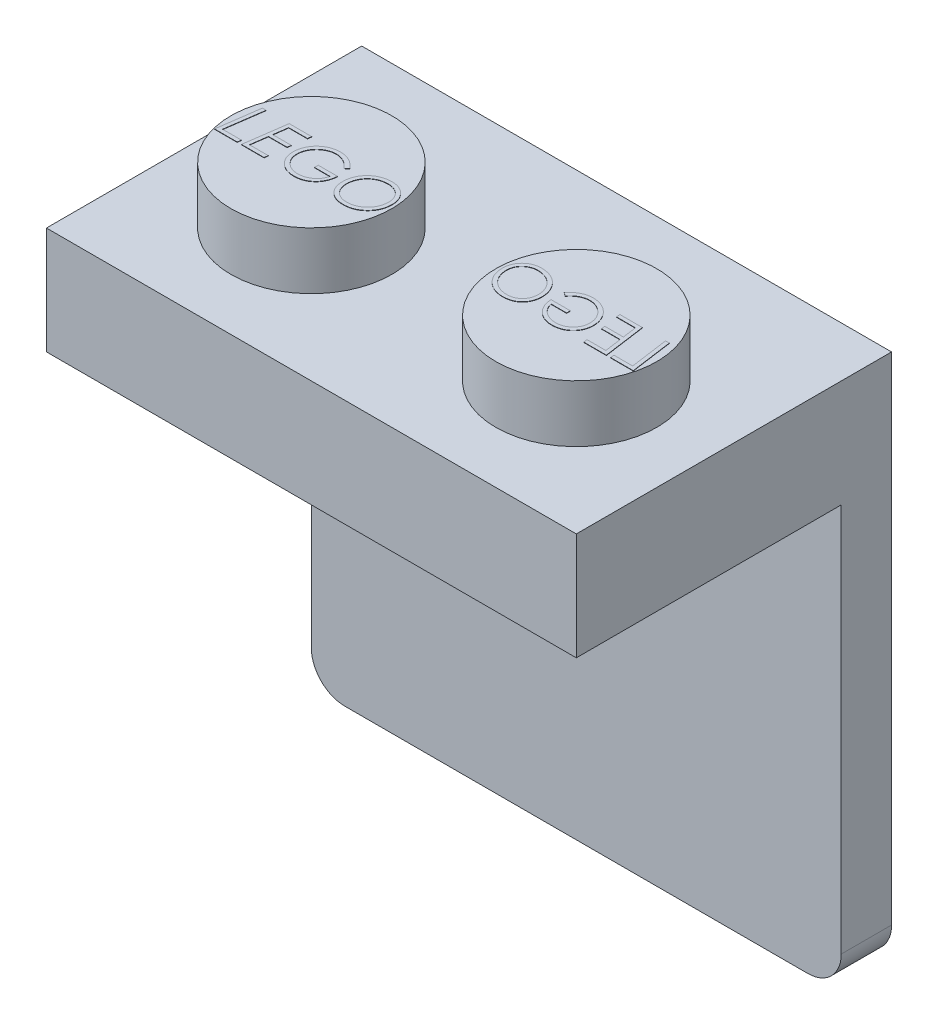
from build123d import *

# Parameters (mm, degrees)
SKETCH1_W           = 7.9
SKETCH1_H           = 7.9
BOSS_EXTRUDE1_DEPTH = 3.2
SKETCH2_R           = 2.4
BOSS_EXTRUDE2_DEPTH = 1.7
BOSS_EXTRUDE4_DEPTH = 0.01
SKETCH4_W           = 6.679581062
SKETCH4_H           = 6.679581062
CUT_EXTRUDE1_DEPTH  = 2.01
BOSS_EXTRUDE5_START = -2.01
BOSS_EXTRUDE5_DEPTH = 2.01
SKETCH6_W           = 15.8
SKETCH6_H           = 15.8
BOSS_EXTRUDE6_DEPTH = 1.5
SKETCH7_R           = 2.4
SKETCH7_R_2         = 1.7
BOSS_EXTRUDE7_DEPTH = 2.9
FILLET1_R           = 1


with BuildPart() as part:
    # Sketch1 → Boss-Extrude1 (new body)
    with BuildSketch(Plane(origin=(0, 0, 0), x_dir=(1, 0, 0), z_dir=(0, 1, 0))):
        with Locations((3.95, 3.95)):
            Rectangle(SKETCH1_W, SKETCH1_H)
    extrude(amount=BOSS_EXTRUDE1_DEPTH)

    # Sketch2 → Boss-Extrude2 (add)
    with BuildSketch(Plane(origin=(0, 3.2, 0), x_dir=(1, 0, 0), z_dir=(0, 1, 0))):
        with Locations(Location((3.95, 3.95, 0), (0, 0, 270))):
            Circle(SKETCH2_R)
    extrude(amount=BOSS_EXTRUDE2_DEPTH)

    # Sketch3 → Boss-Extrude4 (add)
    # profile 1 of 4: a face of its own
    with BuildSketch(Plane(origin=(0, 4.9, 0), x_dir=(1, 0, 0), z_dir=(0, 1, 0))):
        Polygon((1.832282536, 4.604898123), (1.945463626, 4.604898123), (1.785708017, 3.46707761), (2.346104652, 3.46707761), (2.331831815, 3.354898123), (1.657002088, 3.354898123), align=None)
    # profile 2 of 4: a face of its own
    with BuildSketch(Plane(origin=(0, 4.9, 0), x_dir=(1, 0, 0), z_dir=(0, 1, 0))):
        Polygon((3.307643113, 4.604898123), (3.289864668, 4.492718636), (2.730720036, 4.492718636), (2.672376687, 4.076051969), (3.227514908, 4.076051969), (3.211489267, 3.963872482), (2.656351046, 3.963872482), (2.586990069, 3.46707761), (3.147386703, 3.46707761), (3.132863466, 3.354898123), (2.458284139, 3.354898123), (2.633564588, 4.604898123), align=None)
    # profile 3 of 4: a face of its own
    with BuildSketch(Plane(origin=(0, 4.9, 0), x_dir=(1, 0, 0), z_dir=(0, 1, 0))):
        with BuildLine():
            Line((4.701873883, 4.341727049), (4.602214428, 4.268359661))
            add(Edge.make_bspline(
                [(4.602214428, 4.268359661), (4.594223081, 4.278463296), (4.578382454, 4.298490949), (4.552974208, 4.326751799), (4.526781942, 4.353389692), (4.49925824, 4.377917229), (4.471083571, 4.40112998), (4.441525281, 4.42204341), (4.410978563, 4.441207159), (4.379659496, 4.458649755), (4.347610579, 4.474125482), (4.315396207, 4.487732834), (4.282869127, 4.498922357), (4.250283005, 4.50864136), (4.217299487, 4.51587276), (4.18414763, 4.520710487), (4.150903008, 4.524293062), (4.128633082, 4.524610402), (4.117438786, 4.524769918)],
                knots=[0, 0, 0, 0, 1.088205139, 2.157064813, 3.209299296, 4.24303109, 5.270682624, 6.292193363, 7.299904734, 8.316436989, 9.319473328, 10.305733085, 11.269264382, 12.22444877, 13.177574148, 14.119122834, 15.054550362, 16, 16, 16, 16], degree=3))
            add(Edge.make_bspline(
                [(4.117438786, 4.524769918), (4.104994375, 4.524521107), (4.080132736, 4.524024028), (4.043033101, 4.520256885), (4.006376299, 4.51354748), (3.969908323, 4.504926578), (3.933893833, 4.493301772), (3.898252767, 4.479273564), (3.86309309, 4.462612711), (3.828430169, 4.443710217), (3.794953431, 4.422557236), (3.762954424, 4.399818018), (3.733183783, 4.375017311), (3.704650221, 4.34913067), (3.678490591, 4.320990985), (3.654040353, 4.291325456), (3.631570613, 4.259970376), (3.610753816, 4.22729124), (3.592321888, 4.193377608), (3.576332398, 4.158696131), (3.562301633, 4.123622124), (3.551463822, 4.087613068), (3.542488613, 4.051135011), (3.536702509, 4.013925289), (3.532682003, 3.976230124), (3.532229884, 3.950862463), (3.532002088, 3.938081216)],
                knots=[0, 0, 0, 0, 0.97704485, 1.95195533, 2.923843304, 3.901415526, 4.89212417, 5.89249681, 6.906854198, 7.94508701, 8.99059592, 10.014519948, 11.024825533, 12.031297736, 13.037428488, 14.038509295, 15.047964276, 16.064309815, 17.079005887, 18.075937854, 19.061713623, 20.042247028, 21.026191147, 22.008802999, 22.996754876, 24, 24, 24, 24], degree=3))
            add(Edge.make_bspline(
                [(3.532002088, 3.938081216), (3.532369323, 3.920940483), (3.533092921, 3.887166428), (3.54080397, 3.83756171), (3.552297071, 3.789703796), (3.569345009, 3.743984102), (3.590663785, 3.700113704), (3.616898701, 3.658340736), (3.647995923, 3.618632516), (3.683169388, 3.581124089), (3.721975609, 3.547190184), (3.762989457, 3.517071082), (3.806208637, 3.491553815), (3.851780792, 3.471217023), (3.899058754, 3.454481236), (3.948703848, 3.443615036), (4.000192874, 3.436168993), (4.035279814, 3.435410998), (4.053085822, 3.435026328)],
                knots=[0, 0, 0, 0, 1.019699772, 2.00921373, 2.981850619, 3.945611549, 4.907936516, 5.881372837, 6.876399243, 7.906447893, 8.938173367, 9.941073143, 10.932270214, 11.919723139, 12.908225854, 13.912405215, 14.940582182, 16, 16, 16, 16], degree=3))
            add(Edge.make_bspline(
                [(4.053085822, 3.435026328), (4.074581254, 3.435599426), (4.11748625, 3.436743331), (4.180872469, 3.447608002), (4.243162184, 3.464003995), (4.303115661, 3.48756372), (4.359892332, 3.516274774), (4.411741714, 3.54979345), (4.457784869, 3.587961635), (4.498384943, 3.630580026), (4.53303885, 3.678554542), (4.563120551, 3.731230233), (4.587740602, 3.789373269), (4.599634966, 3.830601123), (4.605720036, 3.851692995)],
                knots=[0, 0, 0, 0, 1.033792167, 2.063454529, 3.086685911, 4.12966393, 5.157365104, 6.144632769, 7.094686579, 8.02963692, 8.969786061, 9.935985671, 10.944065236, 12, 12, 12, 12], degree=3))
            Line((4.605720036, 3.851692995), (4.140976447, 3.851692995))
            Line((4.140976447, 3.851692995), (4.140976447, 3.963872482))
            Line((4.140976447, 3.963872482), (4.717899524, 3.963872482))
            add(Edge.make_bspline(
                [(4.717899524, 3.963872482), (4.715864452, 3.940537279), (4.711874195, 3.894782885), (4.69942647, 3.828086612), (4.68199329, 3.764774229), (4.659173945, 3.704861641), (4.630919519, 3.648505742), (4.59774963, 3.595348644), (4.559285746, 3.545571633), (4.515814341, 3.499721655), (4.46844757, 3.458302738), (4.417878433, 3.421925394), (4.364351012, 3.391393009), (4.308182236, 3.366007973), (4.248908241, 3.346854494), (4.187007442, 3.33278705), (4.12217798, 3.324364805), (4.078067373, 3.323359246), (4.055589828, 3.322846841)],
                knots=[0, 0, 0, 0, 1.098006248, 2.152910829, 3.176693714, 4.174102283, 5.154427425, 6.128677043, 7.108165613, 8.099464247, 9.087077226, 10.054952015, 11.015803916, 11.972468591, 12.940477937, 13.931877037, 14.946141749, 16, 16, 16, 16], degree=3))
            add(Edge.make_bspline(
                [(4.055589828, 3.322846841), (4.032525547, 3.323342362), (3.987411429, 3.324311611), (3.9214857, 3.332876212), (3.858807865, 3.34620412), (3.799404334, 3.365318809), (3.743277296, 3.389857102), (3.690679177, 3.420179827), (3.641268759, 3.455657405), (3.595689928, 3.496348401), (3.554559756, 3.541197331), (3.518567584, 3.589307242), (3.487743642, 3.639999747), (3.462901044, 3.693721351), (3.443468533, 3.750181555), (3.429856098, 3.809437188), (3.421311108, 3.871476007), (3.420325278, 3.913764014), (3.419822601, 3.935326809)],
                knots=[0, 0, 0, 0, 1.117903688, 2.186638197, 3.21780727, 4.221242465, 5.20706516, 6.182431358, 7.159609539, 8.151436913, 9.139682433, 10.10533578, 11.060397566, 12.011007066, 12.969638005, 13.950363306, 14.954883424, 16, 16, 16, 16], degree=3))
            add(Edge.make_bspline(
                [(3.419822601, 3.935326809), (3.420138952, 3.950859376), (3.420767729, 3.981731803), (3.424963713, 4.027616327), (3.432679126, 4.072646659), (3.442852825, 4.116910735), (3.455965552, 4.160496846), (3.471933961, 4.20328178), (3.491087489, 4.245242481), (3.513047729, 4.286115161), (3.537530339, 4.325600602), (3.564271155, 4.363247138), (3.593498243, 4.398542313), (3.624507556, 4.432098501), (3.658146201, 4.463054417), (3.693847346, 4.491888255), (3.731480716, 4.518905381), (3.77142415, 4.543221398), (3.812846375, 4.565137356), (3.855118915, 4.584605211), (3.898469674, 4.600573637), (3.942428974, 4.613905323), (3.987291028, 4.624144078), (4.032916476, 4.631801844), (4.079465257, 4.63599767), (4.110753822, 4.636631416), (4.12645321, 4.636949405)],
                knots=[0, 0, 0, 0, 1.01034602, 2.008157081, 2.993527994, 3.979930372, 4.960683832, 5.951959865, 6.948100503, 7.958563211, 8.967975239, 9.968308804, 10.959584837, 11.946808627, 12.938010319, 13.930059161, 14.930392727, 15.949048275, 16.969091794, 17.977364349, 18.973726886, 19.971641333, 20.963333569, 21.964771492, 22.978801278, 24, 24, 24, 24], degree=3))
            add(Edge.make_bspline(
                [(4.12645321, 4.636949405), (4.140647989, 4.63666956), (4.168739982, 4.636115737), (4.210476499, 4.63288549), (4.251380819, 4.627152534), (4.29129634, 4.618801418), (4.330484053, 4.608567941), (4.368675988, 4.59577053), (4.406070924, 4.580754735), (4.442474857, 4.563343269), (4.478143584, 4.543914061), (4.512619765, 4.521658579), (4.546625807, 4.497640881), (4.579591338, 4.471153536), (4.611552577, 4.442077414), (4.642675265, 4.410871755), (4.673242279, 4.377555225), (4.692243855, 4.353777591), (4.701873883, 4.341727049)],
                knots=[0, 0, 0, 0, 1.015105213, 2.008930748, 2.991454354, 3.966534974, 4.923490216, 5.886087319, 6.844809209, 7.803252371, 8.770243484, 9.747130909, 10.735853235, 11.746297741, 12.768902994, 13.824016992, 14.897208497, 16, 16, 16, 16], degree=3))
        make_face()
    # profile 4 of 4: a face of its own
    with BuildSketch(Plane(origin=(0, 4.9, 0), x_dir=(1, 0, 0), z_dir=(0, 1, 0))):
        with BuildLine():
            add(Edge.make_bspline(
                [(5.671925966, 4.636949405), (5.692400623, 4.63650345), (5.732667893, 4.635626396), (5.791703582, 4.627669814), (5.84816478, 4.614697282), (5.901922783, 4.596339067), (5.953136821, 4.572927607), (6.001690741, 4.544284414), (6.047399306, 4.510158163), (6.09025375, 4.471611385), (6.129154607, 4.429051867), (6.163160058, 4.383201547), (6.192058383, 4.334734533), (6.215910086, 4.283554512), (6.233823478, 4.229366588), (6.246743033, 4.172603876), (6.255145963, 4.113110877), (6.255950492, 4.072491917), (6.256361062, 4.051763107)],
                knots=[0, 0, 0, 0, 1.061681398, 2.087996504, 3.083659545, 4.062660971, 5.02945529, 5.999994507, 6.981138296, 7.983640916, 8.985844288, 9.966988076, 10.939736476, 11.908342154, 12.890058995, 13.894159216, 14.925339913, 16, 16, 16, 16], degree=3))
            add(Edge.make_bspline(
                [(6.256361062, 4.051763107), (6.25623821, 4.038988627), (6.255995471, 4.01374805), (6.253408976, 3.976225127), (6.249128591, 3.939561124), (6.243455349, 3.903597875), (6.235835613, 3.868539787), (6.226924527, 3.834140064), (6.216051359, 3.800598383), (6.20384118, 3.767696929), (6.189792262, 3.735595516), (6.173946521, 3.704324105), (6.15669213, 3.673663515), (6.137607818, 3.643838863), (6.11686312, 3.614849105), (6.094393683, 3.586665409), (6.070489857, 3.559187301), (6.044887258, 3.532733386), (6.018336956, 3.507212599), (5.990529993, 3.48355884), (5.962091012, 3.461350566), (5.932834084, 3.440746086), (5.90250067, 3.422121085), (5.871581935, 3.404690573), (5.839905885, 3.388861691), (5.807185809, 3.375183309), (5.773789823, 3.362832151), (5.739620564, 3.352089492), (5.704582969, 3.343076229), (5.668762424, 3.335500733), (5.632062087, 3.329787275), (5.594535036, 3.325855801), (5.556279304, 3.323200874), (5.530454147, 3.322965537), (5.51742877, 3.322846841)],
                knots=[0, 0, 0, 0, 1.057694632, 2.089855924, 3.112648636, 4.113725536, 5.103331559, 6.082381806, 7.055068159, 8.021768845, 8.98743121, 9.954922249, 10.923671581, 11.89959402, 12.885451751, 13.874212627, 14.883322035, 15.900071676, 16.921812937, 17.931632203, 18.921551953, 19.909055848, 20.892997665, 21.867769094, 22.84762411, 23.823252803, 24.802912784, 25.795362855, 26.787788858, 27.797679081, 28.826061376, 29.861826465, 30.921574152, 32, 32, 32, 32], degree=3))
            add(Edge.make_bspline(
                [(5.51742877, 3.322846841), (5.495540081, 3.323312388), (5.45279647, 3.324221496), (5.390401025, 3.331753811), (5.331466149, 3.34468508), (5.275615882, 3.361975519), (5.223270197, 3.38492417), (5.174339628, 3.412892082), (5.128783581, 3.445910526), (5.086763869, 3.483632016), (5.049135515, 3.525626819), (5.016044394, 3.570822838), (4.988418107, 3.619388761), (4.96538613, 3.670881503), (4.948106883, 3.725740589), (4.935156589, 3.783416472), (4.927613141, 3.844314319), (4.926699871, 3.88597706), (4.926232857, 3.907281937)],
                knots=[0, 0, 0, 0, 1.121422378, 2.189881799, 3.214223923, 4.209829567, 5.180887389, 6.136870002, 7.092517675, 8.058664933, 9.02481219, 9.976998316, 10.923432162, 11.882748215, 12.86205079, 13.865508147, 14.908495107, 16, 16, 16, 16], degree=3))
            add(Edge.make_bspline(
                [(4.926232857, 3.907281937), (4.92651465, 3.92390256), (4.927073619, 3.956871533), (4.931757127, 4.005792823), (4.939128338, 4.053761359), (4.950024433, 4.100549976), (4.963594459, 4.14639076), (4.979990494, 4.191253803), (5.000003008, 4.234848241), (5.022452359, 4.277389438), (5.047513645, 4.318359564), (5.07559856, 4.356880644), (5.105216605, 4.393691441), (5.137816677, 4.42780852), (5.172496353, 4.459796588), (5.209524734, 4.489546335), (5.248906172, 4.516814917), (5.290422211, 4.541753927), (5.333531205, 4.564369022), (5.378335052, 4.583562961), (5.424193072, 4.600182058), (5.471345954, 4.613795807), (5.519847317, 4.623918047), (5.569406413, 4.631466127), (5.620254649, 4.636113027), (5.6545551, 4.636668231), (5.671925966, 4.636949405)],
                knots=[0, 0, 0, 0, 1.027038055, 2.037251559, 3.03463374, 4.024476576, 5.003805404, 5.987972729, 6.973761106, 7.966047439, 8.95963362, 9.938921687, 10.910571097, 11.877553313, 12.852319973, 13.824735949, 14.81069978, 15.81041387, 16.816403723, 17.816876174, 18.82042938, 19.829469955, 20.847307225, 21.880377804, 22.926554263, 24, 24, 24, 24], degree=3))
        make_face()
        with BuildLine():
            add(Edge.make_bspline(
                [(5.671925966, 4.524769918), (5.65697579, 4.524545747), (5.627444828, 4.524102944), (5.583747158, 4.520086709), (5.541191397, 4.514393729), (5.499970629, 4.505322476), (5.459846772, 4.494612055), (5.421182876, 4.480527241), (5.383524652, 4.464643931), (5.34726264, 4.446055377), (5.312516644, 4.425361321), (5.279529586, 4.402463835), (5.248469657, 4.377453479), (5.219370347, 4.350164922), (5.191739723, 4.321307483), (5.166361885, 4.289965789), (5.142845474, 4.256628787), (5.121196386, 4.221501346), (5.10164712, 4.185107003), (5.08492909, 4.147719282), (5.070612165, 4.109847114), (5.058744989, 4.071497155), (5.049737471, 4.032481304), (5.043287884, 3.99291855), (5.039049877, 3.95269661), (5.03862585, 3.92565532), (5.038412344, 3.912039549)],
                knots=[0, 0, 0, 0, 1.093710758, 2.16039807, 3.20900896, 4.233234191, 5.246749975, 6.245527847, 7.241594159, 8.235879922, 9.224691631, 10.198908654, 11.171861231, 12.139893662, 13.116290872, 14.093089164, 15.087825051, 16.099756899, 17.110766713, 18.108591704, 19.094380672, 20.071961556, 21.043859171, 22.021859724, 23.00397114, 24, 24, 24, 24], degree=3))
            add(Edge.make_bspline(
                [(5.038412344, 3.912039549), (5.038625982, 3.900599914), (5.039049193, 3.877938292), (5.041777549, 3.844392517), (5.046595514, 3.811801965), (5.053065301, 3.780081073), (5.061542906, 3.749273697), (5.072183234, 3.719394567), (5.084405544, 3.690349568), (5.098393626, 3.662290632), (5.114175341, 3.635553687), (5.131389377, 3.61020951), (5.150226394, 3.586682218), (5.170360361, 3.564729612), (5.191972025, 3.544421151), (5.214980987, 3.52555365), (5.239648771, 3.508615875), (5.265465573, 3.492943288), (5.292687864, 3.479247808), (5.321165948, 3.467438697), (5.350786278, 3.457432665), (5.381544214, 3.449135171), (5.413524888, 3.442928532), (5.44663118, 3.438448028), (5.480905707, 3.435639812), (5.504152208, 3.435232585), (5.515926367, 3.435026328)],
                knots=[0, 0, 0, 0, 1.083699529, 2.146780792, 3.185591126, 4.202843058, 5.211856999, 6.209655863, 7.20532214, 8.195415879, 9.177202942, 10.14436246, 11.095191523, 12.029705806, 12.963818608, 13.902338257, 14.845476191, 15.796042213, 16.761390084, 17.729066592, 18.714222808, 19.721158958, 20.74459932, 21.797962164, 22.884686177, 24, 24, 24, 24], degree=3))
            add(Edge.make_bspline(
                [(5.515926367, 3.435026328), (5.530044188, 3.435228857), (5.558004277, 3.435629962), (5.599524853, 3.440000997), (5.64032433, 3.445959686), (5.680325762, 3.455225454), (5.71965402, 3.466535035), (5.757982705, 3.481070895), (5.795756024, 3.497476377), (5.83237428, 3.51683082), (5.867802238, 3.538111172), (5.901266528, 3.561837848), (5.932774032, 3.587459191), (5.962816859, 3.614626895), (5.990234918, 3.644356353), (6.016009711, 3.675809964), (6.039684501, 3.709331455), (6.061465654, 3.744601276), (6.080935982, 3.781209824), (6.097718361, 3.818903041), (6.112024773, 3.857287248), (6.123844079, 3.896320217), (6.132886835, 3.936161865), (6.139301688, 3.976648339), (6.14355343, 4.017951988), (6.143970816, 4.04574289), (6.144181575, 4.059775927)],
                knots=[0, 0, 0, 0, 1.029812959, 2.039525905, 3.043952503, 4.036919093, 5.033391511, 6.027870106, 7.026035071, 8.036794627, 9.047957848, 10.039952554, 11.027355318, 12.010276797, 12.992858524, 13.975534638, 14.976019862, 15.985163142, 16.99876328, 17.999396818, 18.993875413, 19.986244033, 20.973271002, 21.972624612, 22.976275263, 24, 24, 24, 24], degree=3))
            add(Edge.make_bspline(
                [(6.144181575, 4.059775927), (6.143688983, 4.077993105), (6.142724583, 4.113658826), (6.13551886, 4.16576722), (6.122807184, 4.214771606), (6.105892747, 4.261149785), (6.083400704, 4.304354629), (6.056090597, 4.344736825), (6.024020374, 4.382453222), (5.999069145, 4.404451295), (5.986429171, 4.415595238)],
                knots=[0, 0, 0, 0, 1.085318323, 2.124844004, 3.126009127, 4.096923137, 5.060061729, 6.020100862, 6.997008382, 8, 8, 8, 8], degree=3))
            add(Edge.make_bspline(
                [(5.986429171, 4.415595238), (5.97539623, 4.42431843), (5.953439426, 4.44167857), (5.917982347, 4.463870828), (5.881057133, 4.482788681), (5.842389242, 4.498145486), (5.802091847, 4.510165945), (5.760106575, 4.518646998), (5.716539836, 4.523741692), (5.686963766, 4.524423338), (5.671925966, 4.524769918)],
                knots=[0, 0, 0, 0, 0.992364662, 1.974918139, 2.947382948, 3.917989177, 4.907989082, 5.912266894, 6.938502841, 8, 8, 8, 8], degree=3))
        make_face(mode=Mode.SUBTRACT)
    extrude(amount=BOSS_EXTRUDE4_DEPTH)

    # Sketch4 → Cut-Extrude1 (cut)
    with BuildSketch(Plane.XZ):
        with Locations((3.960209469, -3.960209469)):
            Rectangle(SKETCH4_W, SKETCH4_H)
    extrude(amount=-CUT_EXTRUDE1_DEPTH, mode=Mode.SUBTRACT)

    # Sketch5 → Boss-Extrude5 (add)
    with BuildSketch(Plane(origin=(0, 3.2, 0), x_dir=(1, 0, 0), z_dir=(0, 1, 0)).offset(BOSS_EXTRUDE5_START)):
        with BuildLine():
            Line((6.369527619, 1.557811677), (5.363437843, 1.557811677))
            ThreePointArc((5.363437843, 1.557811677), (6.369527619, 0.551721901), (7.375617394, 1.557811677))
            ThreePointArc((7.375617394, 1.557811677), (7.080940521, 2.269224579), (6.369527619, 2.563901452))
            Line((6.369527619, 2.563901452), (6.369527619, 1.557811677))
        make_face()
        with BuildLine():
            Line((1.458127833, 2.579758881), (1.458127833, 1.557811677))
            Line((1.458127833, 1.557811677), (2.480075037, 1.557811677))
            ThreePointArc((2.480075037, 1.557811677), (2.180753631, 2.280437475), (1.458127833, 2.579758881))
        make_face()
        with BuildLine():
            Line((2.480075037, 1.557811677), (1.458127833, 1.557811677))
            Line((1.458127833, 1.557811677), (1.458127833, 2.579758881))
            ThreePointArc((1.458127833, 2.579758881), (0.735502035, 0.835185879), (2.480075037, 1.557811677))
        make_face()
        with BuildLine():
            ThreePointArc((5.605437996, 2.21232194), (5.425875301, 1.906719887), (5.363437843, 1.557811677))
            Line((5.363437843, 1.557811677), (6.369527619, 1.557811677))
            Line((6.369527619, 1.557811677), (6.369527619, 2.563901452))
            ThreePointArc((6.369527619, 2.563901452), (6.015263465, 2.499466361), (5.706377057, 2.31441459))
            ThreePointArc((5.706377057, 2.31441459), (5.656671092, 2.262613327), (5.605437996, 2.21232194))
        make_face()
        with BuildLine():
            ThreePointArc((7.385597221, 6.365232327), (6.369527619, 7.381301929), (5.353458016, 6.365232327))
            Line((5.353458016, 6.365232327), (6.369527619, 6.365232327))
            Line((6.369527619, 6.365232327), (6.369527619, 5.349162725))
            ThreePointArc((6.369527619, 5.349162725), (7.087997324, 5.646762621), (7.385597221, 6.365232327))
        make_face()
        with BuildLine():
            Line((6.369527619, 6.365232327), (5.353458016, 6.365232327))
            ThreePointArc((5.353458016, 6.365232327), (5.651057913, 5.646762621), (6.369527619, 5.349162725))
            Line((6.369527619, 5.349162725), (6.369527619, 6.365232327))
        make_face()
        with BuildLine():
            ThreePointArc((2.499242709, 6.365232327), (0.721948444, 7.101411716), (1.458127833, 5.324117451))
            Line((1.458127833, 5.324117451), (1.458127833, 6.365232327))
            Line((1.458127833, 6.365232327), (2.499242709, 6.365232327))
        make_face()
        with BuildLine():
            Line((1.458127833, 6.365232327), (1.458127833, 5.324117451))
            ThreePointArc((1.458127833, 5.324117451), (2.194307222, 5.629052938), (2.499242709, 6.365232327))
            Line((2.499242709, 6.365232327), (1.458127833, 6.365232327))
        make_face()
    extrude(amount=BOSS_EXTRUDE5_DEPTH)

    # Mirror1: part across plane


with BuildPart() as part_1:
    add(part.part)
    add(part.part.mirror(Plane(origin=(7.9, 3.2, 0), x_dir=(0, 0, 1), z_dir=(-1, 0, 0))))

    # Sketch6 → Boss-Extrude6 (add)
    with BuildSketch(Plane(origin=(0, 0, -7.9), x_dir=(-1, 0, 0), z_dir=(0, 0, -1))):
        with Locations((-7.9, -4.7)):
            Rectangle(SKETCH6_W, SKETCH6_H)
    extrude(amount=BOSS_EXTRUDE6_DEPTH)

    # Sketch7 → Boss-Extrude7 (add)
    # profile 1 of 4: a face of its own
    with BuildSketch(Plane.XY.offset(-7.9)):
        with Locations((11.85, -0.75)):
            Circle(SKETCH7_R)
        with Locations((11.85, -0.75)):
            Circle(SKETCH7_R_2, mode=Mode.SUBTRACT)
    # profile 2 of 4: a face of its own
    with BuildSketch(Plane.XY.offset(-7.9)):
        with Locations((3.95, -0.75)):
            Circle(SKETCH7_R)
        with Locations((3.95, -0.75)):
            Circle(SKETCH7_R_2, mode=Mode.SUBTRACT)
    # profile 3 of 4: a face of its own
    with BuildSketch(Plane.XY.offset(-7.9)):
        with Locations((3.95, -8.65)):
            Circle(SKETCH7_R)
        with Locations((3.95, -8.65)):
            Circle(SKETCH7_R_2, mode=Mode.SUBTRACT)
    # profile 4 of 4: a face of its own
    with BuildSketch(Plane.XY.offset(-7.9)):
        with Locations((11.85, -8.65)):
            Circle(SKETCH7_R)
        with Locations((11.85, -8.65)):
            Circle(SKETCH7_R_2, mode=Mode.SUBTRACT)
    extrude(amount=-BOSS_EXTRUDE7_DEPTH)

    # Fillet1
    fillet1_edges = [part_1.edges().sort_by_distance(p)[0] for p in [
        (15.8, -12.6, -8.65),
        (0, -12.6, -8.65),
    ]]
    fillet(fillet1_edges, radius=FILLET1_R)


solid = part_1.part
